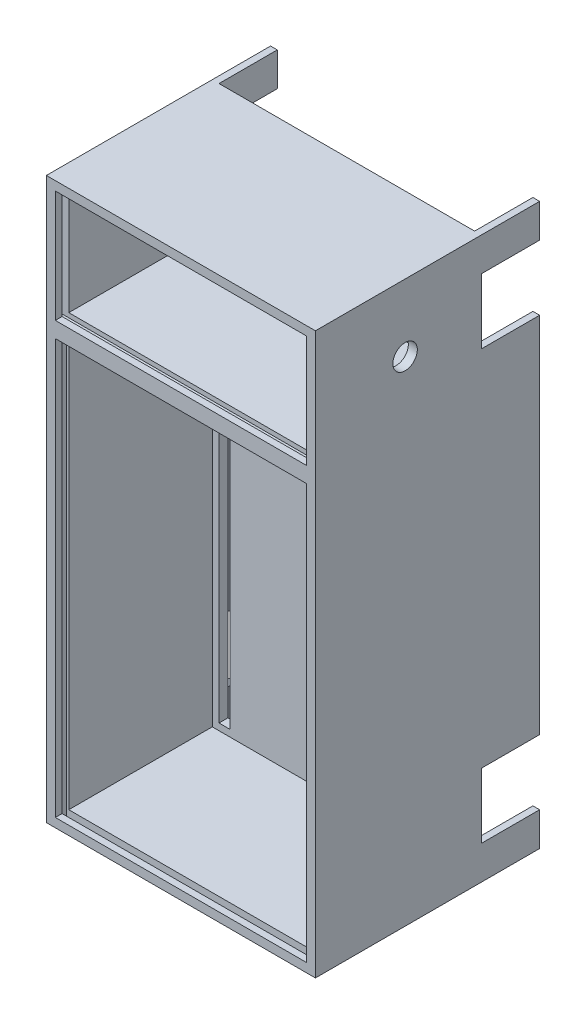
from build123d import *

# Parameters (mm, degrees)
ESBO_O1_W                = 250
ESBO_O1_H                = 120
RESSALTO_EXTRUS_O1_DEPTH = 100
ESBO_O2_W                = 112
ESBO_O2_H                = 50
CORTE_EXTRUS_O1_DEPTH    = 70
ESBO_O3_W                = 54
ESBO_O3_H                = 3
CORTE_EXTRUS_O2_DEPTH    = 118
ESBO_O5_W                = 112
ESBO_O5_H                = 185
CORTE_EXTRUS_O3_DEPTH    = 70
ESBO_O6_W                = 114
ESBO_O6_H                = 3
CORTE_EXTRUS_O4_DEPTH    = 192
ESBO_O7_W                = 114
ESBO_O7_H                = 26
CORTE_EXTRUS_O5_DEPTH    = 500
ESBO_O8_W                = 5
ESBO_O8_H                = 179
CORTE_EXTRUS_O6_DEPTH    = 500
ESBO_O9_W                = 29
ESBO_O9_H                = 26
CORTE_EXTRUS_O7_DEPTH    = 500
ESBO_O10_R               = 5.45
CORTE_EXTRUS_O8_DEPTH    = 10


with BuildPart() as part:
    # Esboço1 → Ressalto-extrusão1 (new body)
    with BuildSketch(Plane(origin=(0, 0, 0), x_dir=(0, 1, 0), z_dir=(0, 0, 1))):
        Rectangle(ESBO_O1_W, ESBO_O1_H)
    extrude(amount=RESSALTO_EXTRUS_O1_DEPTH)

    # Esboço2 → Corte-extrusão1 (cut)
    with BuildSketch(Plane.XY.offset(100)):
        with Locations((0, 96)):
            Rectangle(ESBO_O2_W, ESBO_O2_H)
    extrude(amount=-CORTE_EXTRUS_O1_DEPTH, mode=Mode.SUBTRACT)

    # Esboço3 → Corte-extrusão2 (cut)
    with BuildSketch(Plane(origin=(-60, 0, 0), x_dir=(0, -1, 0), z_dir=(-1, 0, 0))):
        with Locations((-96, 95.5)):
            Rectangle(ESBO_O3_W, ESBO_O3_H)
    extrude(amount=-CORTE_EXTRUS_O2_DEPTH, mode=Mode.SUBTRACT)

    # Esboço5 → Corte-extrusão3 (cut)
    with BuildSketch(Plane.XY.offset(100)):
        with Locations((0, -28.5)):
            Rectangle(ESBO_O5_W, ESBO_O5_H)
    extrude(amount=-CORTE_EXTRUS_O3_DEPTH, mode=Mode.SUBTRACT)

    # Esboço6 → Corte-extrusão4 (cut)
    with BuildSketch(Plane.XZ.offset(125)):
        with Locations((0, 95.5)):
            Rectangle(ESBO_O6_W, ESBO_O6_H)
    extrude(amount=-CORTE_EXTRUS_O4_DEPTH, mode=Mode.SUBTRACT)

    # Esboço7 → Corte-extrusão5 (cut)
    with BuildSketch(Plane.XZ.offset(125)):
        with Locations((0, 13)):
            Rectangle(ESBO_O7_W, ESBO_O7_H)
    extrude(amount=-CORTE_EXTRUS_O5_DEPTH, mode=Mode.SUBTRACT)

    # Esboço8 → Corte-extrusão6 (cut)
    with BuildSketch(Plane.XY.offset(30)):
        with Locations((-50.5, -28.5)):
            Rectangle(ESBO_O8_W, ESBO_O8_H)
    corte_extrus_o6 = extrude(amount=-CORTE_EXTRUS_O6_DEPTH, mode=Mode.SUBTRACT)

    # Espelhar1: Corte-extrusão6 across plane
    add(corte_extrus_o6.mirror(Plane(origin=(0, 0, 0), x_dir=(0, 0, 1), z_dir=(1, 0, 0))), mode=Mode.SUBTRACT)

    # Esboço9 → Corte-extrusão7 (cut)
    with BuildSketch(Plane(origin=(-60, 0, 0), x_dir=(0, -1, 0), z_dir=(-1, 0, 0))):
        with Locations((-95.5, 13)):
            Rectangle(ESBO_O9_W, ESBO_O9_H)
    corte_extrus_o7 = extrude(amount=-CORTE_EXTRUS_O7_DEPTH, mode=Mode.SUBTRACT)

    # Espelhar2: Corte-extrusão7 across plane
    add(corte_extrus_o7.mirror(Plane.ZX), mode=Mode.SUBTRACT)

    # Esboço10 → Corte-extrusão8 (cut)
    with BuildSketch(Plane.YZ.offset(60)):
        with Locations((95, 60)):
            Circle(ESBO_O10_R)
    extrude(amount=-CORTE_EXTRUS_O8_DEPTH, mode=Mode.SUBTRACT)


solid = part.part
